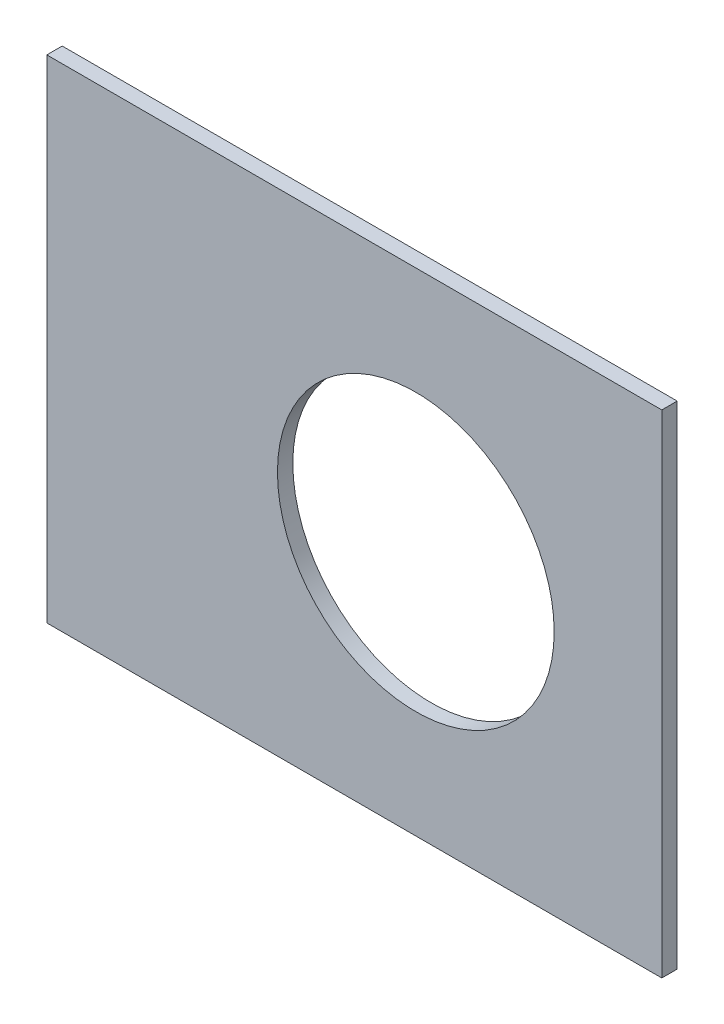
from build123d import *

# Parameters (mm, degrees)
SKETCH_1_W      = 200
SKETCH_1_H      = 160
SKETCH_1_R      = 45
EXTRUDE_2_DEPTH = 5


with BuildPart() as part:
    # 草图1 → 凸台-拉伸2 (new body)
    with BuildSketch(Plane.XY):
        with Locations((100, 80)):
            Rectangle(SKETCH_1_W, SKETCH_1_H)
        with Locations((120, 80)):
            Circle(SKETCH_1_R, mode=Mode.SUBTRACT)
    extrude(amount=EXTRUDE_2_DEPTH)


solid = part.part
